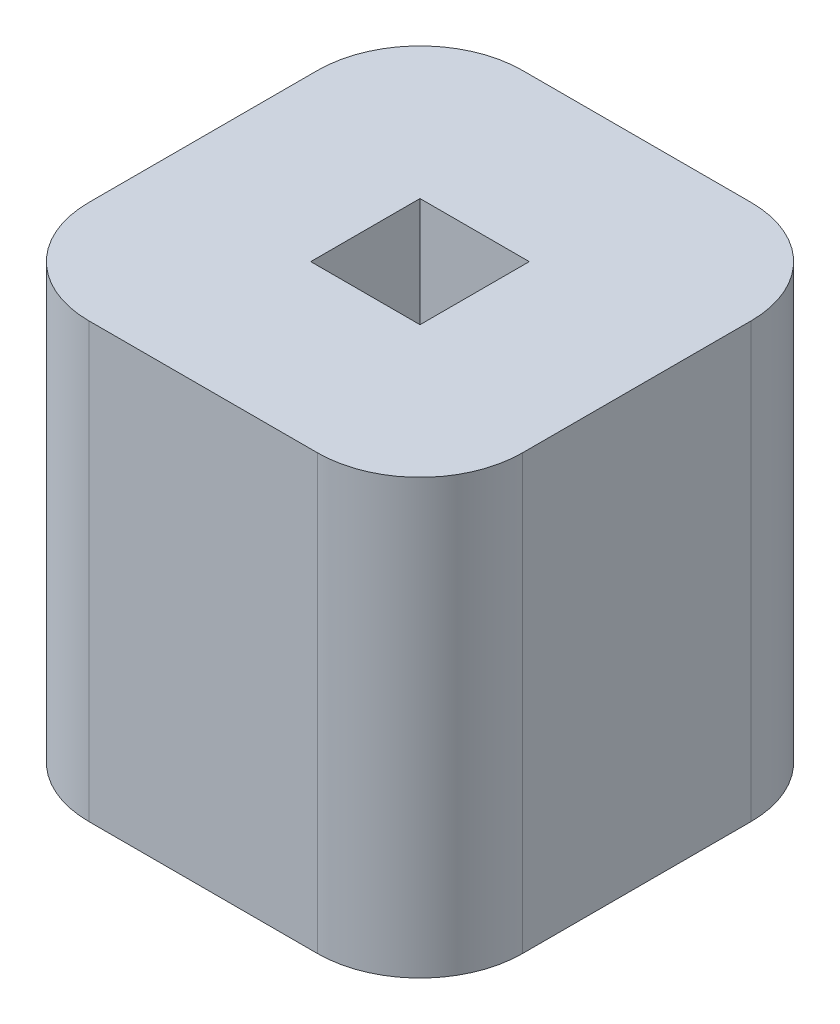
from build123d import *

# Parameters (mm, degrees)
SKETCH1_W           = 2.54
SKETCH1_H           = 2.54
BOSS_EXTRUDE1_DEPTH = 2.54
SKETCH2_W           = 0.64
SKETCH2_H           = 0.64
CUT_EXTRUDE1_DEPTH  = 2.54
FILLET2_R           = 0.6
FILLET3_R           = 0.6
FILLET4_R           = 0.6
FILLET5_R           = 0.6


with BuildPart() as part:
    # Sketch1 → Boss-Extrude1 (new body)
    with BuildSketch(Plane(origin=(0, 0, 0), x_dir=(1, 0, 0), z_dir=(0, 1, 0))):
        with Locations((0.216186367, 0.241282018)):
            Rectangle(SKETCH1_W, SKETCH1_H)
    extrude(amount=BOSS_EXTRUDE1_DEPTH)

    # Sketch2 → Cut-Extrude1 (cut)
    with BuildSketch(Plane(origin=(0, 2.54, 0), x_dir=(1, 0, 0), z_dir=(0, 1, 0))):
        with Locations((0.216186367, 0.241282018)):
            Rectangle(SKETCH2_W, SKETCH2_H)
    extrude(amount=-CUT_EXTRUDE1_DEPTH, mode=Mode.SUBTRACT)

    # Fillet2
    fillet2_edges = [part.edges().sort_by_distance(p)[0] for p in [
        (-1.053813633, 1.27, -1.511282018),
    ]]
    fillet(fillet2_edges, radius=FILLET2_R)

    # Fillet3
    fillet3_edges = [part.edges().sort_by_distance(p)[0] for p in [
        (-1.053813633, 1.27, 1.028717982),
    ]]
    fillet(fillet3_edges, radius=FILLET3_R)

    # Fillet4
    fillet4_edges = [part.edges().sort_by_distance(p)[0] for p in [
        (1.486186367, 1.27, 1.028717982),
    ]]
    fillet(fillet4_edges, radius=FILLET4_R)

    # Fillet5
    fillet5_edges = [part.edges().sort_by_distance(p)[0] for p in [
        (1.486186367, 1.27, -1.511282018),
    ]]
    fillet(fillet5_edges, radius=FILLET5_R)


solid = part.part
